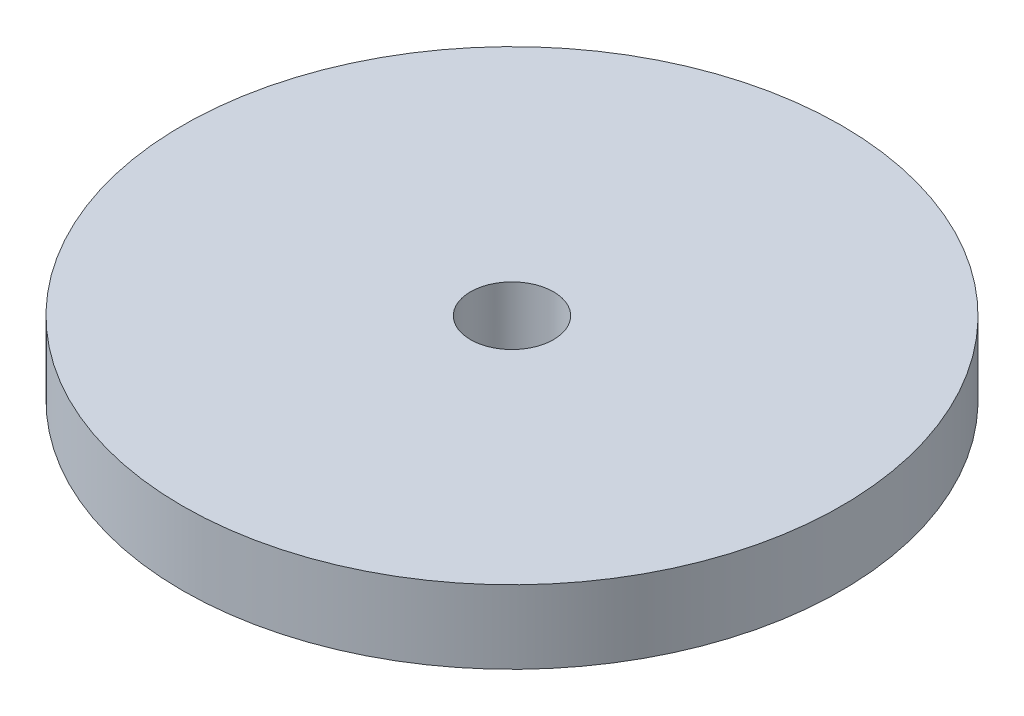
from build123d import *

# Parameters (mm, degrees)
SKETCH1_R                      = 13.5
BOSS_EXTRUDE1_DEPTH            = 3
M3_CLEARANCE_HOLE1_D           = 3.4
M3_CLEARANCE_HOLE1_CSINK_D     = 3.45
M3_CLEARANCE_HOLE1_CSINK_ANGLE = 90


with BuildPart() as part:
    # Sketch1 → Boss-Extrude1 (new body)
    with BuildSketch(Plane(origin=(0, 0, 0), x_dir=(1, 0, 0), z_dir=(0, 1, 0))):
        with Locations(Location((0, 0, 0), (0, 0, 270))):
            Circle(SKETCH1_R)
    extrude(amount=BOSS_EXTRUDE1_DEPTH)

    # M3 Clearance Hole1 (through all)
    with Locations(Plane(origin=(0, 0, 0), x_dir=(-1, 0, 0), z_dir=(0, -1, 0))):
        with Locations((0, 0)):
            CounterSinkHole(M3_CLEARANCE_HOLE1_D / 2, M3_CLEARANCE_HOLE1_CSINK_D / 2, counter_sink_angle=M3_CLEARANCE_HOLE1_CSINK_ANGLE)


solid = part.part
